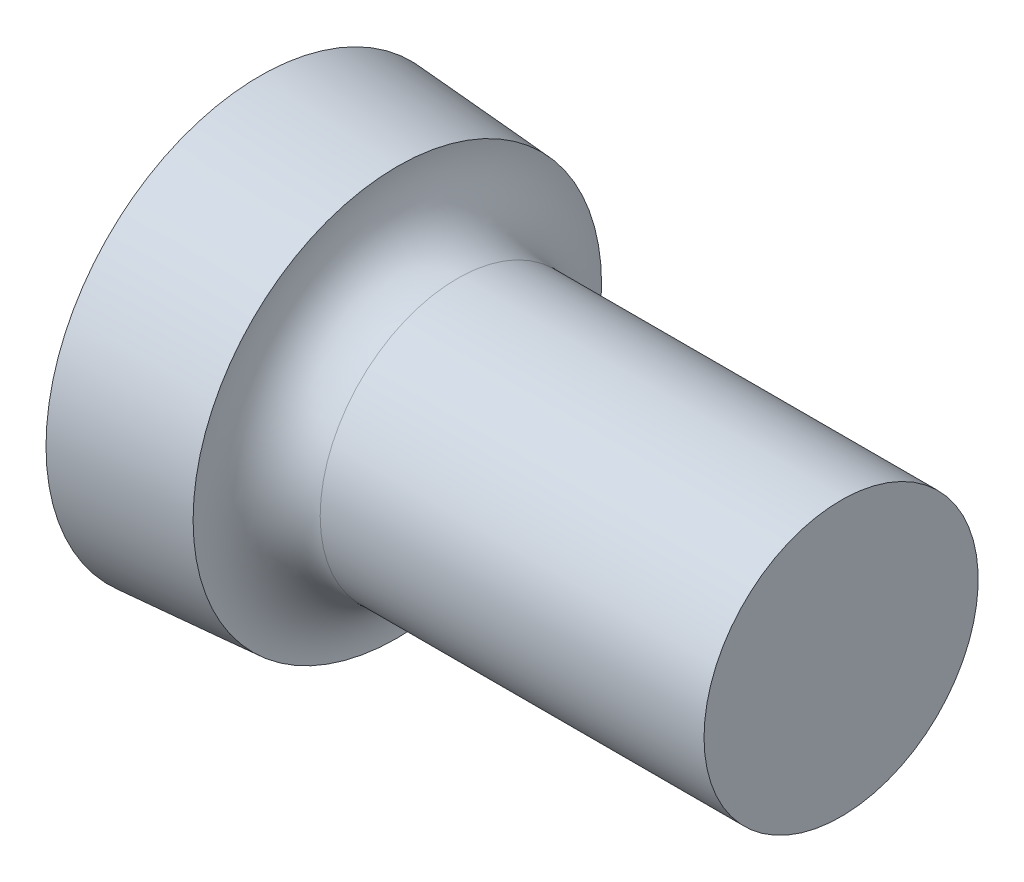
from build123d import *


with BuildPart() as part:
    # Szkic1 → Obrót1 (revolve)
    with BuildSketch(Plane.XY, mode=Mode.PRIVATE) as obr_t1_sk:
        with BuildLine():
            Line((5.3, 0), (5.3, 1.25))
            Line((5.3, 1.25), (1.8, 1.25))
            ThreePointArc((1.8, 1.25), (1.38964102, 1.433795811), (1.25354481, 1.862343608))
            Line((1.25354481, 1.862343608), (0, 1.95))
            Line((0, 1.95), (0, 0))
            Line((0, 0), (5.3, 0))
        make_face()
    revolve(obr_t1_sk.sketch.rotate(Axis((0, 0, 0), (1, 0, 0)), 90), axis=Axis((0, 0, 0), (1, 0, 0)))


solid = part.part
